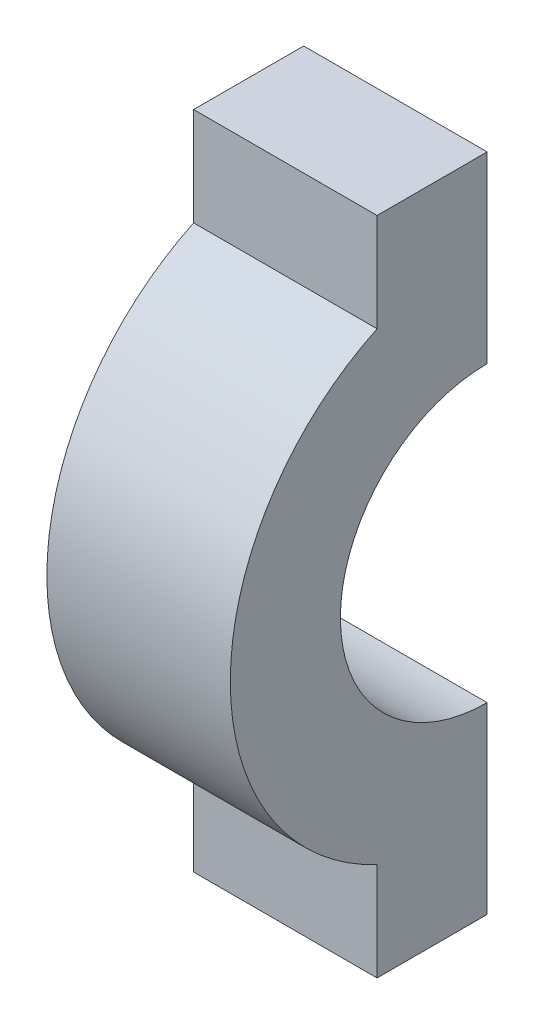
from build123d import *

# Parameters (mm, degrees)
EXTRUDE_1_DEPTH = 5


with BuildPart() as part:
    # 草图1 → 凸台-拉伸1 (new, symmetric)
    with BuildSketch(Plane(origin=(10, 0, 0), x_dir=(0, 0, -1), z_dir=(1, 0, 0))):
        with BuildLine():
            Line((-18, 80), (-18, 90))
            Line((-18, 90), (-24, 90))
            Line((-24, 90), (-24, 84.649110641))
            ThreePointArc((-24, 84.649110641), (-32, 72), (-24, 59.350889359))
            Line((-24, 59.350889359), (-24, 54))
            Line((-24, 54), (-18, 54))
            Line((-18, 54), (-18, 64))
            ThreePointArc((-18, 64), (-26, 72), (-18, 80))
        make_face()
    extrude(amount=EXTRUDE_1_DEPTH, both=True)


solid = part.part
